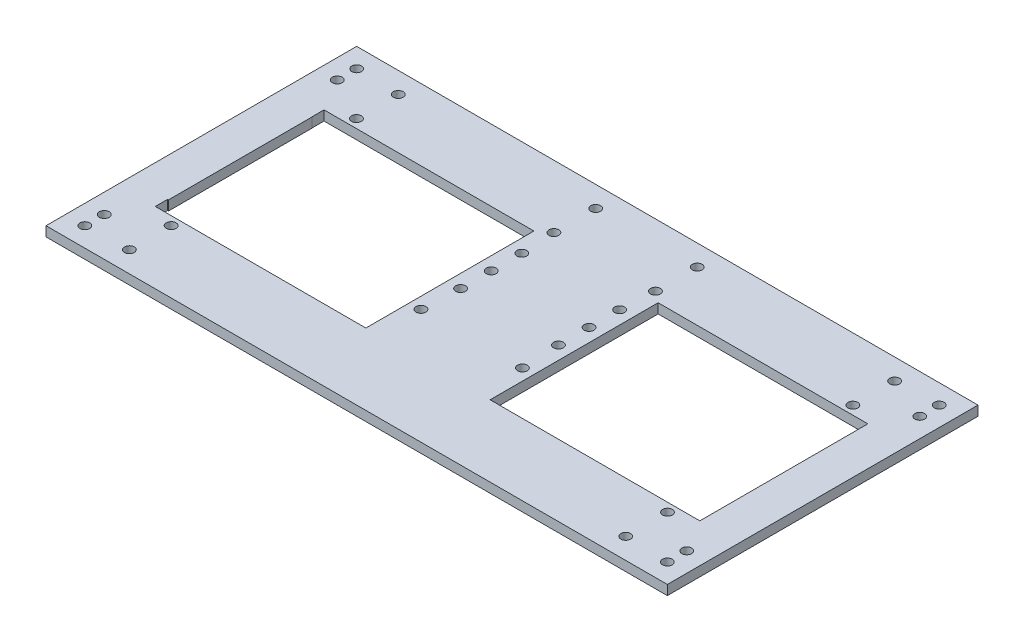
from build123d import *

# Parameters (mm, degrees)
SKETCH1_W           = 203.2
SKETCH1_H           = 101.6
SKETCH1_R           = 1.6
SKETCH1_W_2         = 68.58
SKETCH1_H_2         = 54.953705786
BOSS_EXTRUDE1_DEPTH = 3.175
SKETCH2_R           = 1.6
CUT_EXTRUDE1_DEPTH  = 10


with BuildPart() as part:
    # Sketch1 → Boss-Extrude1 (new body)
    with BuildSketch(Plane(origin=(0, 0, 0), x_dir=(1, 0, 0), z_dir=(0, 1, 0))):
        with Locations((101.6, -50.8)):
            Rectangle(SKETCH1_W, SKETCH1_H)
        with Locations(Location((20.431013284, -94.769213223, 0), (0, 0, 270))):
            Circle(SKETCH1_R, mode=Mode.SUBTRACT)
        with Locations(Location((20.431013284, -81.10763967, 0), (0, 0, 270))):
            Circle(SKETCH1_R, mode=Mode.SUBTRACT)
        Polygon((81.28, -23.323147107), (81.28, -78.276852893), (12.405089541, -78.276852893), (12.405089541, -74.276852893), (12.7, -74.276852893), (12.7, -27.323147107), (12.648382796, -27.323147107), (12.648382796, -23.323147107), align=None, mode=Mode.SUBTRACT)
        with Locations(Location((85, -63.98136033, 0), (0, 0, 270))):
            Circle(SKETCH1_R, mode=Mode.SUBTRACT)
        with Locations(Location((85.6, -51.6, 0), (0, 0, 270))):
            Circle(SKETCH1_R, mode=Mode.SUBTRACT)
        with Locations(Location((182.768986716, -94.769213223, 0), (0, 0, 270))):
            Circle(SKETCH1_R, mode=Mode.SUBTRACT)
        with Locations(Location((182.768986716, -81.10763967, 0), (0, 0, 270))):
            Circle(SKETCH1_R, mode=Mode.SUBTRACT)
        with Locations(Location((118.2, -63.98136033, 0), (0, 0, 270))):
            Circle(SKETCH1_R, mode=Mode.SUBTRACT)
        with Locations(Location((117.6, -51.6, 0), (0, 0, 270))):
            Circle(SKETCH1_R, mode=Mode.SUBTRACT)
        with Locations((156.21, -50.8)):
            Rectangle(SKETCH1_W_2, SKETCH1_H_2, mode=Mode.SUBTRACT)
        with Locations(Location((85.6, -41.6, 0), (0, 0, 270))):
            Circle(SKETCH1_R, mode=Mode.SUBTRACT)
        with Locations(Location((85.6, -31.6, 0), (0, 0, 270))):
            Circle(SKETCH1_R, mode=Mode.SUBTRACT)
        with Locations(Location((20.431013284, -20.49236033, 0), (0, 0, 270))):
            Circle(SKETCH1_R, mode=Mode.SUBTRACT)
        with Locations(Location((20.431013284, -6.830786777, 0), (0, 0, 270))):
            Circle(SKETCH1_R, mode=Mode.SUBTRACT)
        with Locations(Location((85, -20.49236033, 0), (0, 0, 270))):
            Circle(SKETCH1_R, mode=Mode.SUBTRACT)
        with Locations(Location((85, -6.830786777, 0), (0, 0, 270))):
            Circle(SKETCH1_R, mode=Mode.SUBTRACT)
        with Locations(Location((117.6, -41.6, 0), (0, 0, 270))):
            Circle(SKETCH1_R, mode=Mode.SUBTRACT)
        with Locations(Location((117.6, -31.6, 0), (0, 0, 270))):
            Circle(SKETCH1_R, mode=Mode.SUBTRACT)
        with Locations(Location((118.2, -20.49236033, 0), (0, 0, 270))):
            Circle(SKETCH1_R, mode=Mode.SUBTRACT)
        with Locations(Location((118.2, -6.830786777, 0), (0, 0, 270))):
            Circle(SKETCH1_R, mode=Mode.SUBTRACT)
        with Locations(Location((182.768986716, -20.49236033, 0), (0, 0, 270))):
            Circle(SKETCH1_R, mode=Mode.SUBTRACT)
        with Locations(Location((182.768986716, -6.830786777, 0), (0, 0, 270))):
            Circle(SKETCH1_R, mode=Mode.SUBTRACT)
    extrude(amount=-BOSS_EXTRUDE1_DEPTH)

    # Sketch2 → Cut-Extrude1 (cut)
    with BuildSketch(Plane.XZ.offset(3.175)):
        with Locations(Location((6.35, 12.7, 0), (0, 0, 270))):
            Circle(SKETCH2_R)
        with Locations(Location((6.35, 95.25, 0), (0, 0, 270))):
            Circle(SKETCH2_R)
        with Locations(Location((6.35, 88.9, 0), (0, 0, 270))):
            Circle(SKETCH2_R)
        with Locations(Location((196.85, 6.35, 0), (0, 0, 270))):
            Circle(SKETCH2_R)
        with Locations(Location((196.85, 12.7, 0), (0, 0, 270))):
            Circle(SKETCH2_R)
        with Locations(Location((196.85, 88.9, 0), (0, 0, 270))):
            Circle(SKETCH2_R)
        with Locations(Location((6.35, 6.35, 0), (0, 0, 270))):
            Circle(SKETCH2_R)
        with Locations(Location((196.85, 95.25, 0), (0, 0, 270))):
            Circle(SKETCH2_R)
    extrude(amount=-CUT_EXTRUDE1_DEPTH, mode=Mode.SUBTRACT)


solid = part.part
